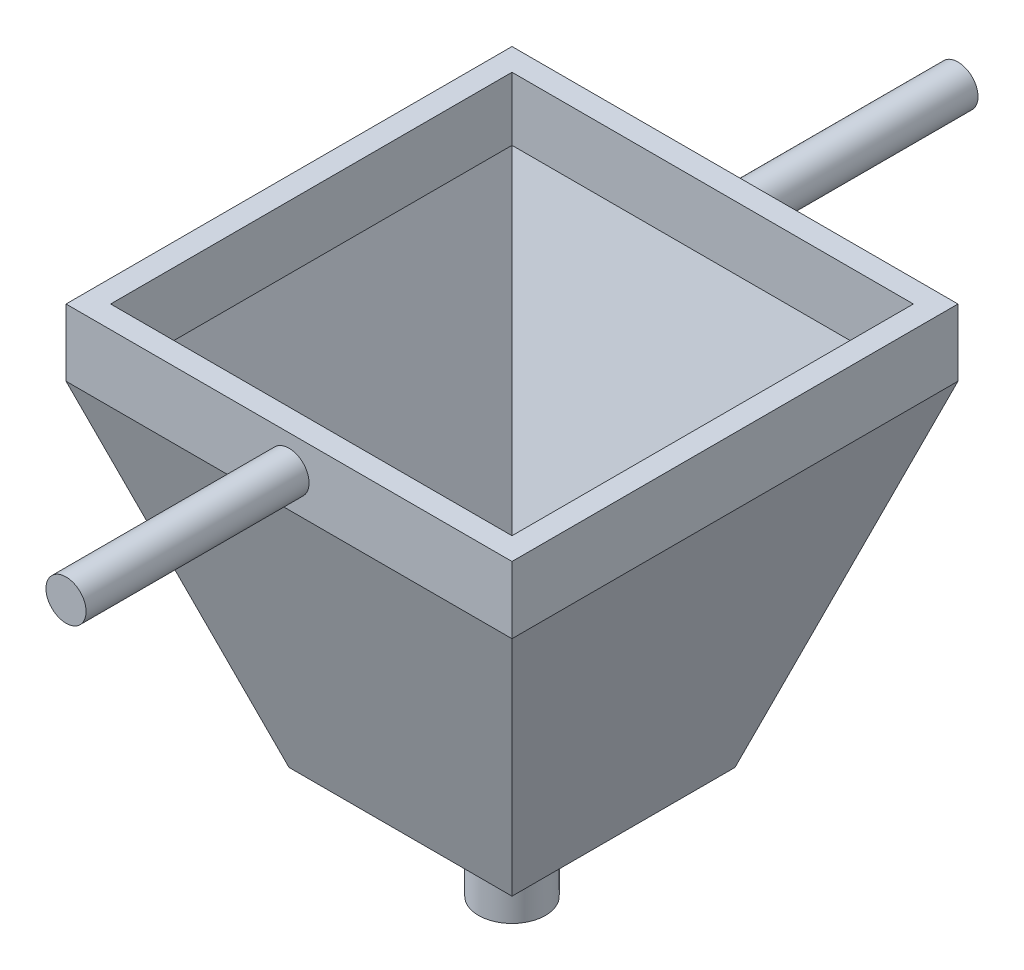
from build123d import *

# Parameters (mm, degrees)
CROQUIS3_W                 = 20
CROQUIS3_H                 = 20
SALIENTE_EXTRUIR1_DEPTH    = 3
VACIADO2_T                 = -1
CROQUIS4_R                 = 1.5
CORTAR_EXTRUIR1_DEPTH      = 3
CROQUIS5_R                 = 1.5
SALIENTE_EXTRUIR2_DEPTH    = 5
CROQUIS6_R                 = 1.355898714
CORTAR_EXTRUIR2_DEPTH      = 15
CROQUIS7_R                 = 1
SALIENTE_EXTRUIR4_DEPTH    = 1.5
CORTAR_EXTRUIR3_DEPTH      = 31.5
CORTAR_EXTRUIR3_DEPTH_BACK = 1.5
CROQUIS10_R                = 1.406391719
CROQUIS11_R                = 0.9
CORTAR_EXTRUIR4_DEPTH      = 0.2
CORTAR_EXTRUIR5_START      = -0.2
CROQUIS12_R                = 0.9
CORTAR_EXTRUIR5_DEPTH      = 0.2
CROQUIS15_R                = 0.9
SALIENTE_EXTRUIR6_DEPTH    = 10
CROQUIS16_R                = 0.9
SALIENTE_EXTRUIR7_DEPTH    = 10


with BuildPart() as part:
    # Croquis2 → Recubrir1 section 0
    with BuildSketch(Plane(origin=(0, 15, 0), x_dir=(1, 0, 0), z_dir=(0, 1, 0))):
        with BuildLine():
            Line((-10, -10), (10, -10))
            Line((10, -10), (10, 10))
            Line((10, 10), (-10, 10))
            Line((-10, 10), (-10, -10))
        make_face()
    # Croquis1 → Recubrir1 section 1
    with BuildSketch(Plane(origin=(0, 0, 0), x_dir=(1, 0, 0), z_dir=(0, 1, 0))):
        with BuildLine():
            Line((-5, -5), (5, -5))
            Line((5, -5), (5, 5))
            Line((5, 5), (-5, 5))
            Line((-5, 5), (-5, -5))
        make_face()
    loft()

    # Croquis3 → Saliente-Extruir1 (add)
    with BuildSketch(Plane(origin=(0, 15, 0), x_dir=(1, 0, 0), z_dir=(0, 1, 0))):
        Rectangle(CROQUIS3_W, CROQUIS3_H)
    extrude(amount=SALIENTE_EXTRUIR1_DEPTH)

    # Vaciado2
    vaciado2_openings = [part.faces().sort_by_distance(p)[0] for p in [
        (0, 18, 0),
    ]]
    offset(amount=VACIADO2_T, openings=vaciado2_openings, kind=Kind.INTERSECTION)

    # Croquis4 → Cortar-Extruir1 (cut)
    with BuildSketch(Plane(origin=(0, 0, 0), x_dir=(-1, 0, 0), z_dir=(0, -1, 0))):
        with Locations(Location((0, 0, 0), (0, 0, 90))):
            Circle(CROQUIS4_R)
    extrude(amount=-CORTAR_EXTRUIR1_DEPTH, mode=Mode.SUBTRACT)

    # Croquis11 → Cortar-Extruir4 (cut)
    with BuildSketch(Plane(origin=(0, 0, -10), x_dir=(-1, 0, 0), z_dir=(0, 0, -1))):
        with Locations((0, 16.5)):
            Circle(CROQUIS11_R)
    extrude(amount=-CORTAR_EXTRUIR4_DEPTH, mode=Mode.SUBTRACT)

    # Croquis12 → Cortar-Extruir5 (cut)
    with BuildSketch(Plane.XY.offset(10).offset(CORTAR_EXTRUIR5_START)):
        with Locations(Location((0, 16.5, 0), (0, 0, 180))):
            Circle(CROQUIS12_R)
    extrude(amount=CORTAR_EXTRUIR5_DEPTH, mode=Mode.SUBTRACT)


with BuildPart() as body_2:
    # Croquis5 → Saliente-Extruir2 (new body)
    with BuildSketch(Plane(origin=(0, 0, 0), x_dir=(-1, 0, 0), z_dir=(0, -1, 0))):
        with Locations(Location((0, 0, 0), (0, 0, 90))):
            Circle(CROQUIS5_R)
    extrude(amount=SALIENTE_EXTRUIR2_DEPTH)

    # Croquis6 → Cortar-Extruir2 (cut)
    with BuildSketch(Plane(origin=(0, -5, 0), x_dir=(-1, 0, 0), z_dir=(0, -1, 0))):
        with Locations(Location((0, 0, 0), (0, 0, 90))):
            Circle(CROQUIS6_R)
    extrude(amount=-CORTAR_EXTRUIR2_DEPTH, mode=Mode.SUBTRACT)

    # Croquis7 → Saliente-Extruir4 (add)
    with BuildSketch(Plane(origin=(0, 0, 0), x_dir=(0, 0, -1), z_dir=(1, 0, 0))):
        with Locations(Location((0, -2.4391778, 0), (0, 0, 180))):
            Circle(CROQUIS7_R)
    extrude(amount=SALIENTE_EXTRUIR4_DEPTH)

    # Croquis10 → Cortar-Extruir3 (cut, two sides: drawn at the far end of the back side and taken through both)
    with BuildSketch(Plane(origin=(0, 0, 0), x_dir=(-1, 0, 0), z_dir=(0, -1, 0)).offset(-CORTAR_EXTRUIR3_DEPTH_BACK)):
        with Locations(Location((0, 0, 0), (0, 0, 90))):
            Circle(CROQUIS10_R)
    extrude(amount=CORTAR_EXTRUIR3_DEPTH + CORTAR_EXTRUIR3_DEPTH_BACK, mode=Mode.SUBTRACT)


with BuildPart() as body_3:
    # Croquis15 → Saliente-Extruir6 (new body)
    with BuildSketch(Plane(origin=(0, 0, -10), x_dir=(-1, 0, 0), z_dir=(0, 0, -1))):
        with Locations((0, 16.5)):
            Circle(CROQUIS15_R)
    extrude(amount=SALIENTE_EXTRUIR6_DEPTH)


with BuildPart() as body_4:
    # Croquis16 → Saliente-Extruir7 (new body)
    with BuildSketch(Plane.XY.offset(10)):
        with Locations((0, 16.5)):
            Circle(CROQUIS16_R)
    extrude(amount=SALIENTE_EXTRUIR7_DEPTH)


solid = Compound([part.part, body_2.part, body_3.part, body_4.part])
